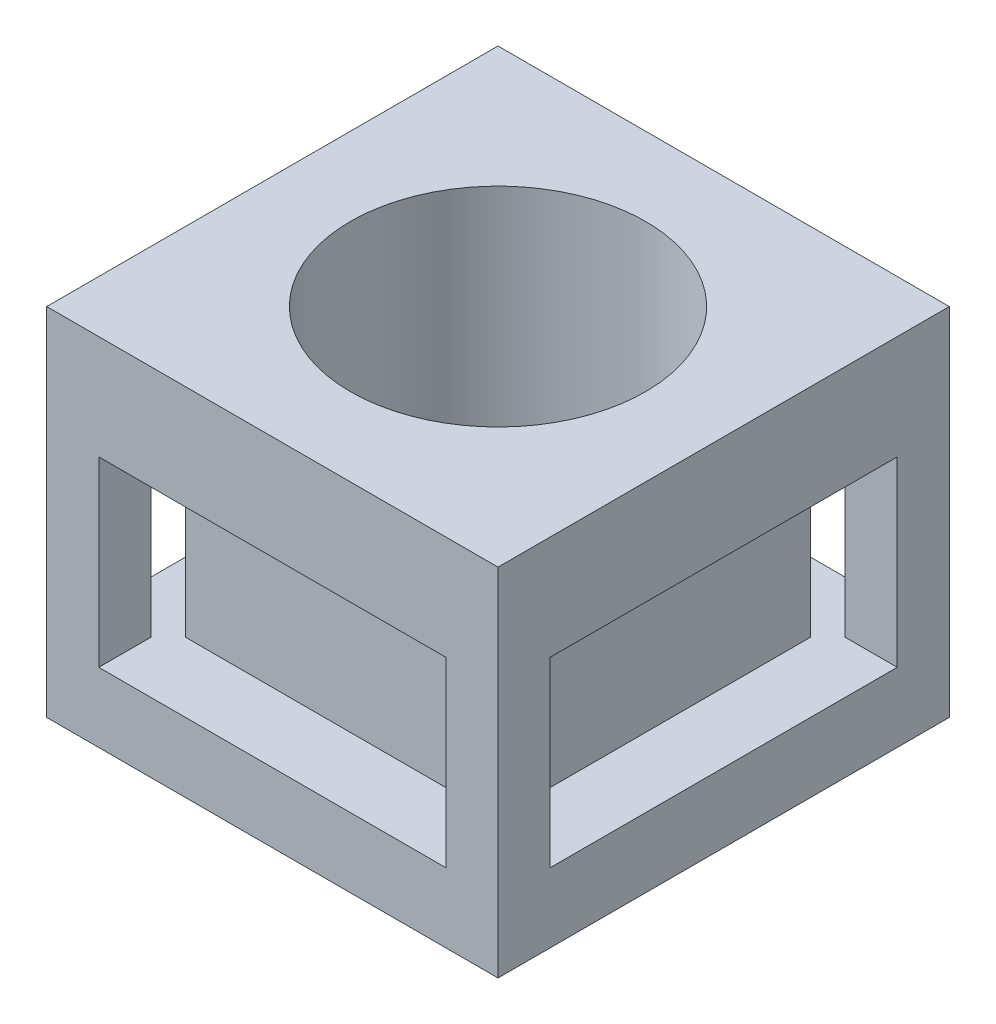
from build123d import *

# Parameters (mm, degrees)
SKETCH2_W                = 26
SKETCH2_H                = 20.5
BOSS_EXTRUDE1_DEPTH      = 26
HAPTUATOR_HOLE_R         = 8.5
HAPTUATORINSERTION_DEPTH = 12.5
SKETCH8_R                = 3.989772047
CLEARANCE_DEPTH          = 43.09809972
CUTOUT_W                 = 20
CUTOUT_H                 = 10.5
CUT_EXTRUDE3_DEPTH       = 4
CIRPATTERN1_COUNT        = 4


with BuildPart() as part:
    # Sketch2 → Boss-Extrude1 (new body)
    with BuildSketch(Plane.XY):
        with Locations((13, 10.25)):
            Rectangle(SKETCH2_W, SKETCH2_H)
    extrude(amount=BOSS_EXTRUDE1_DEPTH)

    # Haptuator Hole → HaptuatorInsertion (cut)
    with BuildSketch(Plane(origin=(0, 20.5, 0), x_dir=(1, 0, 0), z_dir=(0, 1, 0))):
        with Locations((13, -13)):
            Circle(HAPTUATOR_HOLE_R)
    extrude(amount=-HAPTUATORINSERTION_DEPTH, mode=Mode.SUBTRACT)

    # Sketch8 → Clearance (cut, through all)
    with BuildSketch(Plane.XZ):
        with Locations((13, 13)):
            Circle(SKETCH8_R)
    extrude(amount=-CLEARANCE_DEPTH, mode=Mode.SUBTRACT)

    # cutout → Cut-Extrude3 (cut)
    with BuildSketch(Plane.XY.offset(26)):
        with Locations((13, 9.25)):
            Rectangle(CUTOUT_W, CUTOUT_H)
    cut_extrude3 = extrude(amount=-CUT_EXTRUDE3_DEPTH, mode=Mode.SUBTRACT)

    # CirPattern1: Cut-Extrude3 ×4 about axis
    cirpattern1_axis = Axis((13, -1.025, 13), (0, 1, 0))
    for i in range(1, CIRPATTERN1_COUNT):
        add(cut_extrude3.rotate(cirpattern1_axis, i * 360 / CIRPATTERN1_COUNT), mode=Mode.SUBTRACT)


solid = part.part
